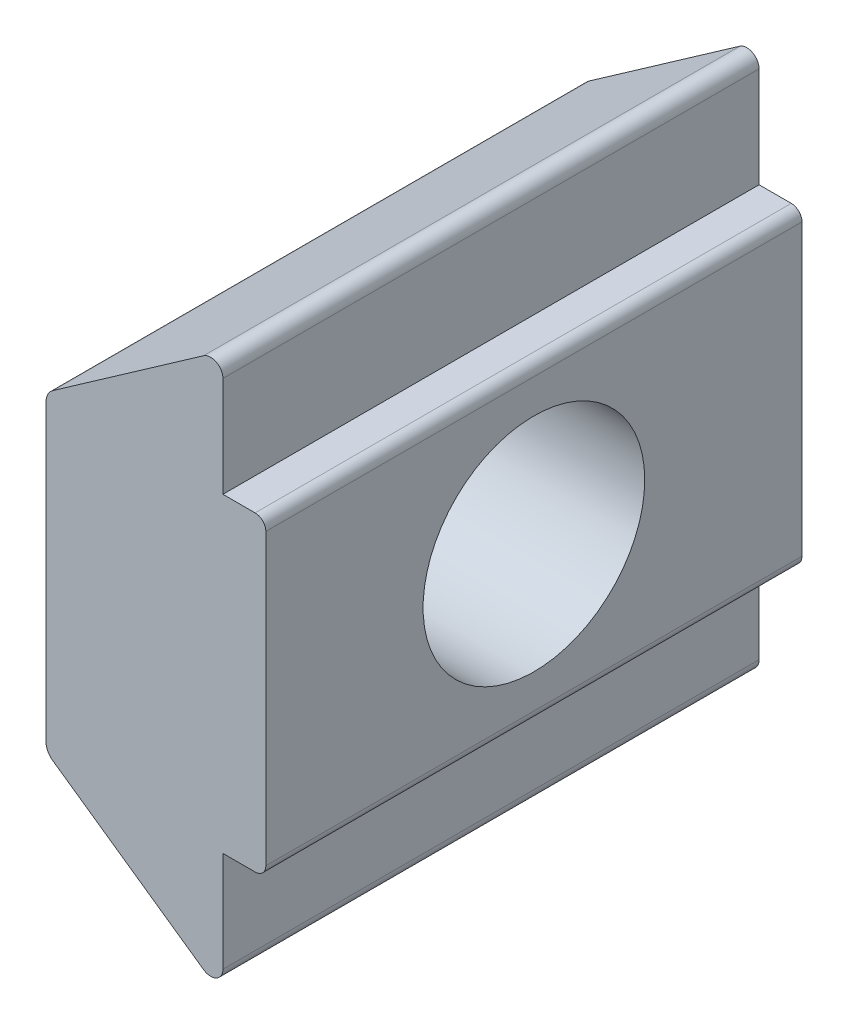
from build123d import *

# Parameters (mm, degrees)
BOSS_EXTRUDE1_DEPTH = 5
TAP1_D              = 4.134


with BuildPart() as part:
    # Sketch1 → Boss-Extrude1 (new, symmetric)
    with BuildSketch(Plane.XY):
        with BuildLine():
            Line((-4.1, 2.743829885), (-4.1, -2.743829885))
            ThreePointArc((-4.1, -2.743829885), (-4.06610325, -2.882354469), (-3.972072931, -2.989575498))
            Line((-3.972072931, -2.989575498), (-1.159973062, -4.958629024))
            ThreePointArc((-1.159973062, -4.958629024), (-0.923130974, -4.974152475), (-0.8, -4.771238909))
            Line((-0.8, -4.771238909), (-0.8, -2.9))
            Line((-0.8, -2.9), (-0.2, -2.9))
            ThreePointArc((-0.2, -2.9), (-0.058578644, -2.841421356), (0, -2.7))
            Line((0, -2.7), (0, 2.7))
            ThreePointArc((0, 2.7), (-0.058578644, 2.841421356), (-0.2, 2.9))
            Line((-0.2, 2.9), (-0.8, 2.9))
            Line((-0.8, 2.9), (-0.8, 4.771238909))
            ThreePointArc((-0.8, 4.771238909), (-0.923130974, 4.974152475), (-1.159973062, 4.958629024))
            Line((-1.159973062, 4.958629024), (-3.972072931, 2.989575498))
            ThreePointArc((-3.972072931, 2.989575498), (-4.06610325, 2.882354469), (-4.1, 2.743829885))
        make_face()
    extrude(amount=BOSS_EXTRUDE1_DEPTH, both=True)

    # Tap1 (through all)
    with Locations(Plane(origin=(0, 0, 0), x_dir=(0, 0, -1), z_dir=(1, 0, 0))):
        with Locations((0, 0)):
            Hole(TAP1_D / 2)


solid = part.part
